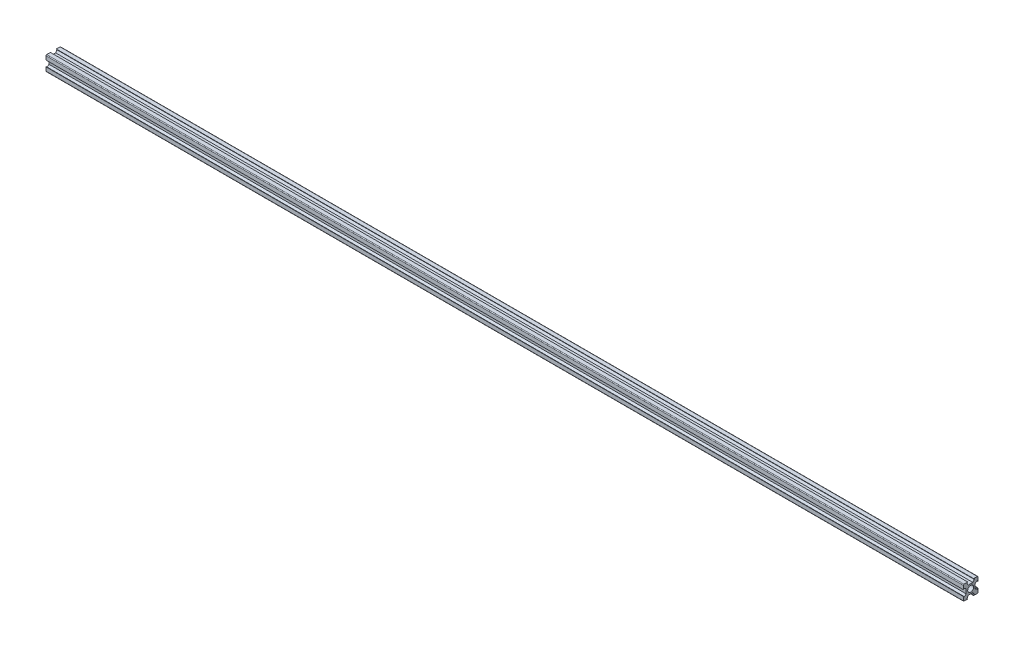
from build123d import *

# Parameters (mm, degrees)
SKETCH_1_W                       = 1246
SKETCH_1_H                       = 10
EXTRUDE_1_DEPTH                  = 10
SKETCH_2_R                       = 4
CUT_EXTRUDE_1_DEPTH              = 1270
CUT_EXTRUDE_2_DEPTH              = 1270
FILLET_1_R                       = 1
PATTERN_CIRCULAR_2_COUNT         = 4
FILLET_1_OF_PATTERN_CIRCULAR_2_R = 1


with BuildPart() as part:
    # 草图1 → 凸台-拉伸1 (new body)
    with BuildSketch(Plane.XY):
        with Locations((556.481285353, -6.397869645)):
            Rectangle(SKETCH_1_W, SKETCH_1_H)
    extrude_1 = extrude(amount=EXTRUDE_1_DEPTH)

    # 草图2 → 切除-拉伸1 (cut)
    with BuildSketch(Plane(origin=(1179.481285353, 0, 0), x_dir=(0, 0, -1), z_dir=(1, 0, 0))):
        with Locations((0, -11.397869645)):
            Circle(SKETCH_2_R)
    cut_extrude_1 = extrude(amount=-CUT_EXTRUDE_1_DEPTH, mode=Mode.SUBTRACT)

    # 草图3 → 切除-拉伸2 (cut)
    with BuildSketch(Plane(origin=(1179.481285353, 0, 0), x_dir=(0, 0, -1), z_dir=(1, 0, 0))):
        Polygon((-4, -1.397869645), (0, -1.397869645), (0, -5.397869645), (-3, -5.397869645), (-5.5, -1.897869645), (-4, -1.897869645), align=None)
        Polygon((-10, -7.397869645), (-10, -11.397869645), (-6, -11.397869645), (-6, -8.397869645), (-9.5, -5.897869645), (-9.5, -7.397869645), align=None)
    cut_extrude_2 = extrude(amount=-CUT_EXTRUDE_2_DEPTH, mode=Mode.SUBTRACT)

    # 圆角1
    fillet_1_edges = [part.edges().sort_by_distance(p)[0] for p in [
        (556.481285353, -1.397869645, 10),
    ]]
    fillet(fillet_1_edges, radius=FILLET_1_R)

    # 阵列(圆周)2: 凸台-拉伸1, 切除-拉伸1, 切除-拉伸2 ×4 about axis
    pattern_circular_2_axis = Axis((0, -11.397869645, 0), (1, 0, 0))
    add([extrude_1.rotate(pattern_circular_2_axis, i * 360 / PATTERN_CIRCULAR_2_COUNT) for i in range(1, PATTERN_CIRCULAR_2_COUNT)])
    add([cut_extrude_1.rotate(pattern_circular_2_axis, i * 360 / PATTERN_CIRCULAR_2_COUNT) for i in range(1, PATTERN_CIRCULAR_2_COUNT)], mode=Mode.SUBTRACT)
    add([cut_extrude_2.rotate(pattern_circular_2_axis, i * 360 / PATTERN_CIRCULAR_2_COUNT) for i in range(1, PATTERN_CIRCULAR_2_COUNT)], mode=Mode.SUBTRACT)

    # 圆角1 of 阵列(圆周)2
    fillet_1_of_pattern_circular_2_edges = [part.edges().sort_by_distance(p)[0] for p in [
        (556.481285353, -21.397869645, 10),
        (556.481285353, -21.397869645, -10),
        (556.481285353, -1.397869645, -10),
    ]]
    fillet(fillet_1_of_pattern_circular_2_edges, radius=FILLET_1_OF_PATTERN_CIRCULAR_2_R)


solid = part.part
